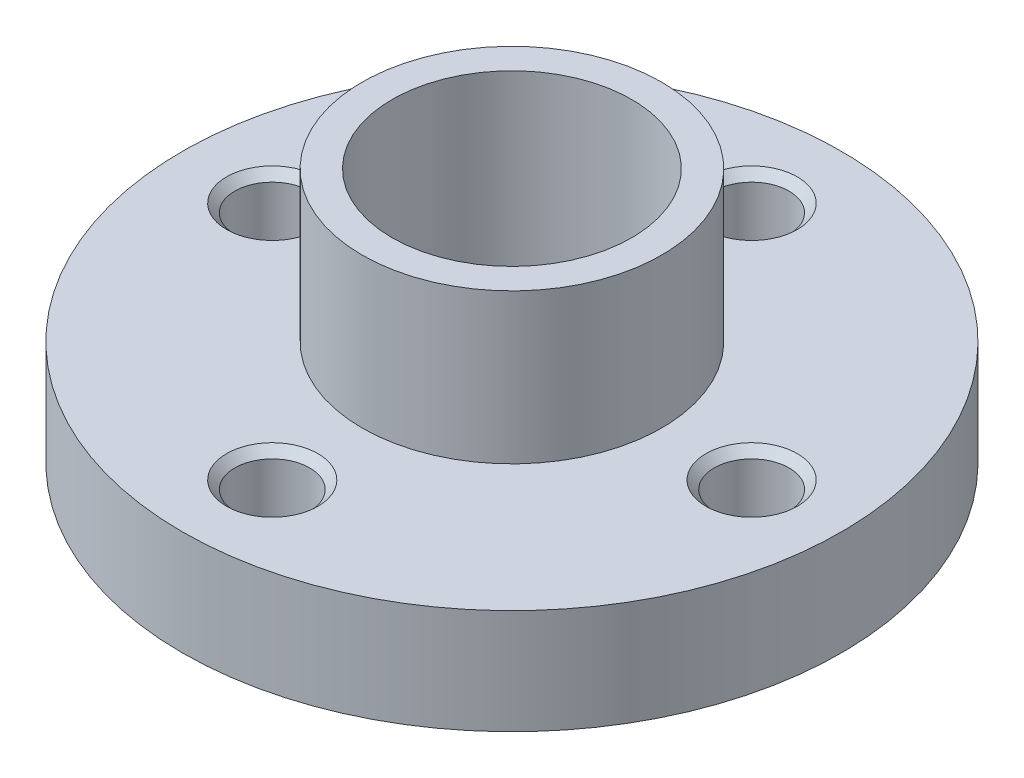
from build123d import *

# Parameters (mm, degrees)
SKETCH_1_R                   = 11
EXTRUDE_1_DEPTH              = 3.5
EXTRUDE_2_DEPTH              = 5
EXTRUDE_2_DEPTH_BACK         = 5.5
SKETCH_2_R                   = 5
SKETCH_3_R                   = 1.15
CUT_EXTRUDE_1_DEPTH          = 5
SKETCH_4_R                   = 4
CUT_EXTRUDE_2_DEPTH          = 19.768324379
HOLE_WIZARD_M3_1_D           = 2.5
HOLE_WIZARD_M3_1_DEPTH       = 8.5
HOLE_WIZARD_M3_1_CSINK_D     = 3.05
HOLE_WIZARD_M3_1_CSINK_ANGLE = 90
HOLE_WIZARD_M3_1_TIP         = 0.751075774


with BuildPart() as part:
    # 草图1 → 凸台-拉伸1 (new body)
    with BuildSketch(Plane(origin=(0, 0, 0), x_dir=(1, 0, 0), z_dir=(0, 1, 0))):
        Circle(SKETCH_1_R)
    extrude(amount=EXTRUDE_1_DEPTH)

    # 草图2 → 凸台-拉伸2 (add, two sides: drawn at the far end of the back side and taken through both)
    with BuildSketch(Plane(origin=(0, 3.5, 0), x_dir=(1, 0, 0), z_dir=(0, 1, 0)).offset(-EXTRUDE_2_DEPTH_BACK)):
        Circle(SKETCH_2_R)
    extrude(amount=EXTRUDE_2_DEPTH + EXTRUDE_2_DEPTH_BACK)

    # 草图3 → 切除-拉伸1 (cut)
    with BuildSketch(Plane(origin=(0, 3.5, 0), x_dir=(1, 0, 0), z_dir=(0, 1, 0))):
        with Locations((0, 8)):
            Circle(SKETCH_3_R)
        with Locations((8, 0)):
            Circle(SKETCH_3_R)
        with Locations((0, -8)):
            Circle(SKETCH_3_R)
        with Locations((-8, 0)):
            Circle(SKETCH_3_R)
    extrude(amount=-CUT_EXTRUDE_1_DEPTH, mode=Mode.SUBTRACT)

    # 草图4 → 切除-拉伸2 (cut, through all)
    with BuildSketch(Plane(origin=(0, 8.5, 0), x_dir=(1, 0, 0), z_dir=(0, 1, 0))):
        Circle(SKETCH_4_R)
    extrude(amount=-CUT_EXTRUDE_2_DEPTH, mode=Mode.SUBTRACT)

    # M3 螺纹孔1
    with Locations(Plane(origin=(0, 3.5, 0), x_dir=(1, 0, 0), z_dir=(0, 1, 0))):
        with Locations((0, 8), (8, 0), (0, -8), (-8, 0)):
            CounterSinkHole(HOLE_WIZARD_M3_1_D / 2, HOLE_WIZARD_M3_1_CSINK_D / 2, depth=HOLE_WIZARD_M3_1_DEPTH, counter_sink_angle=HOLE_WIZARD_M3_1_CSINK_ANGLE)
            with Locations((0, 0, -(HOLE_WIZARD_M3_1_DEPTH + HOLE_WIZARD_M3_1_TIP / 2))):  # 118° drill point
                Cone(0, HOLE_WIZARD_M3_1_D / 2, HOLE_WIZARD_M3_1_TIP, mode=Mode.SUBTRACT)


solid = part.part
